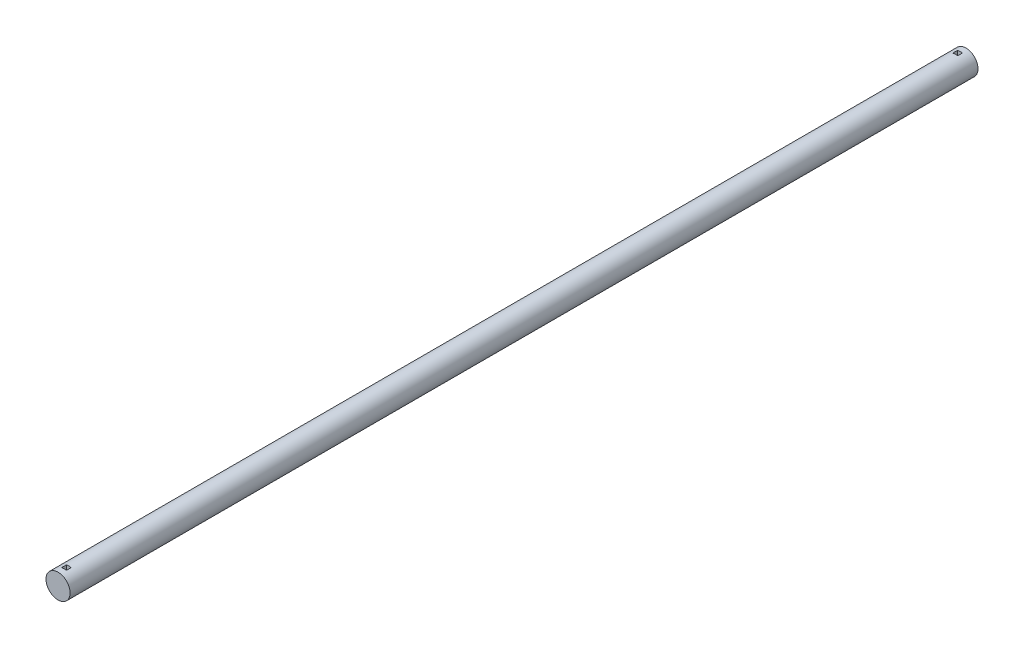
from build123d import *

# Parameters (mm, degrees)
SKETCH1_R           = 50.5
BOSS_EXTRUDE1_DEPTH = 3800
SKETCH2_W           = 20
SKETCH2_H           = 20
CUT_EXTRUDE1_DEPTH  = 3801.671059168


with BuildPart() as part:
    # Sketch1 → Boss-Extrude1 (new body)
    with BuildSketch(Plane.XY):
        with Locations(Location((0, 0, 0), (0, 0, 180))):
            Circle(SKETCH1_R)
    extrude(amount=BOSS_EXTRUDE1_DEPTH)

    # Sketch2 → Cut-Extrude1 (cut, symmetric)
    with BuildSketch(Plane(origin=(0, 0, 0), x_dir=(1, 0, 0), z_dir=(0, 1, 0))):
        with Locations((0, -35)):
            Rectangle(SKETCH2_W, SKETCH2_H)
    cut_extrude1 = extrude(amount=CUT_EXTRUDE1_DEPTH, both=True, mode=Mode.SUBTRACT)

    # Mirror1: Cut-Extrude1 across plane
    add(cut_extrude1.mirror(Plane(origin=(0, 0, 1900), x_dir=(1, 0, 0), z_dir=(0, 0, -1))), mode=Mode.SUBTRACT)


solid = part.part
